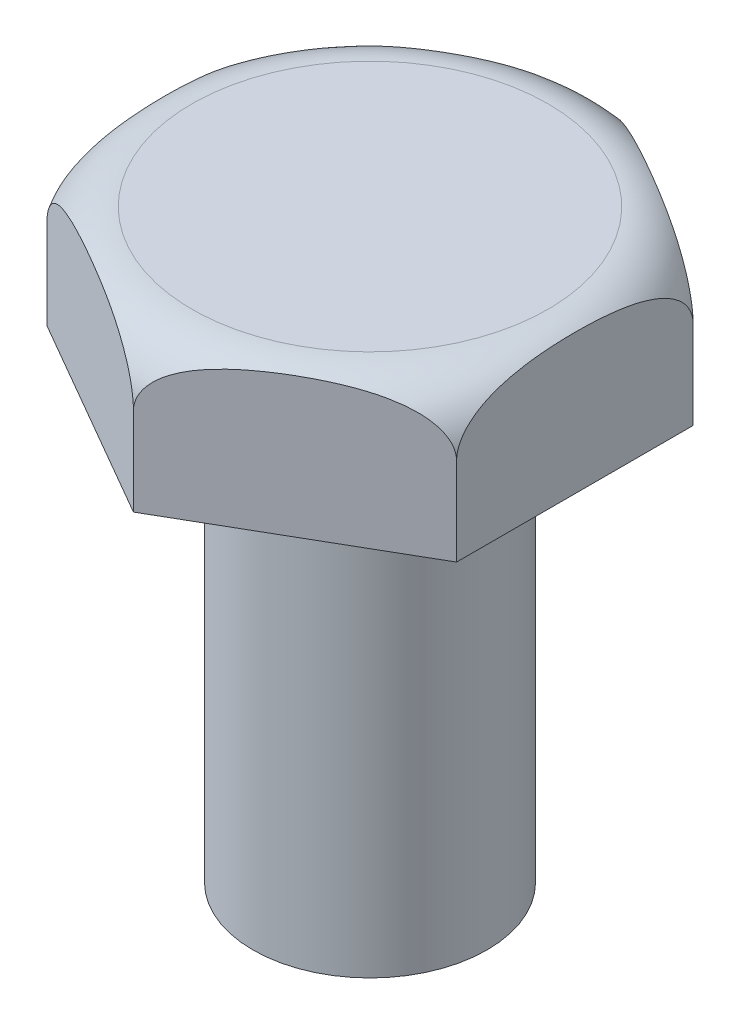
from build123d import *

# Parameters (mm, degrees)
SKETCH1_R           = 4
BOSS_EXTRUDE1_DEPTH = 15
BOSS_EXTRUDE2_DEPTH = 5


with BuildPart() as part:
    # Sketch1 → Boss-Extrude1 (new body)
    with BuildSketch(Plane(origin=(0, 0, 0), x_dir=(1, 0, 0), z_dir=(0, 1, 0))):
        with Locations(Location((0, 0, 0), (0, 0, 270))):
            Circle(SKETCH1_R)
    extrude(amount=BOSS_EXTRUDE1_DEPTH)

    # Sketch2 → Boss-Extrude2 (add)
    with BuildSketch(Plane(origin=(0, 15, 0), x_dir=(1, 0, 0), z_dir=(0, 1, 0))):
        Polygon((0, -8.082903769), (7, -4.041451884), (7, 4.041451884), (0, 8.082903769), (-7, 4.041451884), (-7, -4.041451884), align=None)
    extrude(amount=BOSS_EXTRUDE2_DEPTH)

    # Sketch4 → Cut-Revolve2 (revolve, cut)
    with BuildSketch(Plane(origin=(0, 0, 0), x_dir=(0, 0, -1), z_dir=(1, 0, 0)), mode=Mode.PRIVATE) as cut_revolve2_sk:
        with BuildLine():
            Line((-6.082903769, 20), (-8.082903769, 20))
            Line((-8.082903769, 20), (-8.082903769, 18))
            ThreePointArc((-8.082903769, 18), (-7.497117331, 19.414213562), (-6.082903769, 20))
        make_face()
    revolve(cut_revolve2_sk.sketch.rotate(Axis((0, 0, 0), (0, 1, 0)), 180), axis=Axis((0, 0, 0), (0, 1, 0)), mode=Mode.SUBTRACT)


solid = part.part
